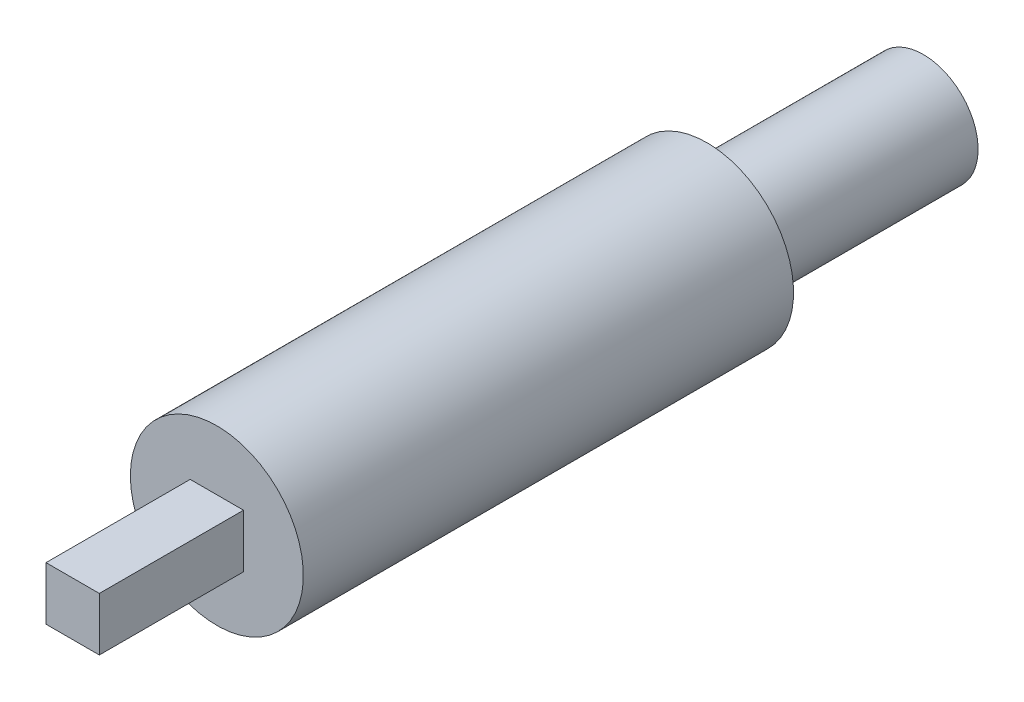
from build123d import *

# Parameters (mm, degrees)
SKETCH1_W      = 3.7
SKETCH1_H      = 3.7
EXTRUDE1_DEPTH = 10
SKETCH2_R      = 6
EXTRUDE2_DEPTH = 34
SKETCH3_R      = 3.8
EXTRUDE3_DEPTH = 15


with BuildPart() as part:
    # Sketch1 → Extrude1 (new body)
    with BuildSketch(Plane.XY):
        Rectangle(SKETCH1_W, SKETCH1_H)
    extrude(amount=EXTRUDE1_DEPTH)

    # Sketch2 → Extrude2 (add)
    with BuildSketch(Plane(origin=(0, 0, 0), x_dir=(-1, 0, 0), z_dir=(0, 0, -1))):
        Circle(SKETCH2_R)
    extrude(amount=EXTRUDE2_DEPTH)

    # Sketch3 → Extrude3 (add)
    with BuildSketch(Plane(origin=(0, 0, -34), x_dir=(-1, 0, 0), z_dir=(0, 0, -1))):
        Circle(SKETCH3_R)
    extrude(amount=EXTRUDE3_DEPTH)


solid = part.part
